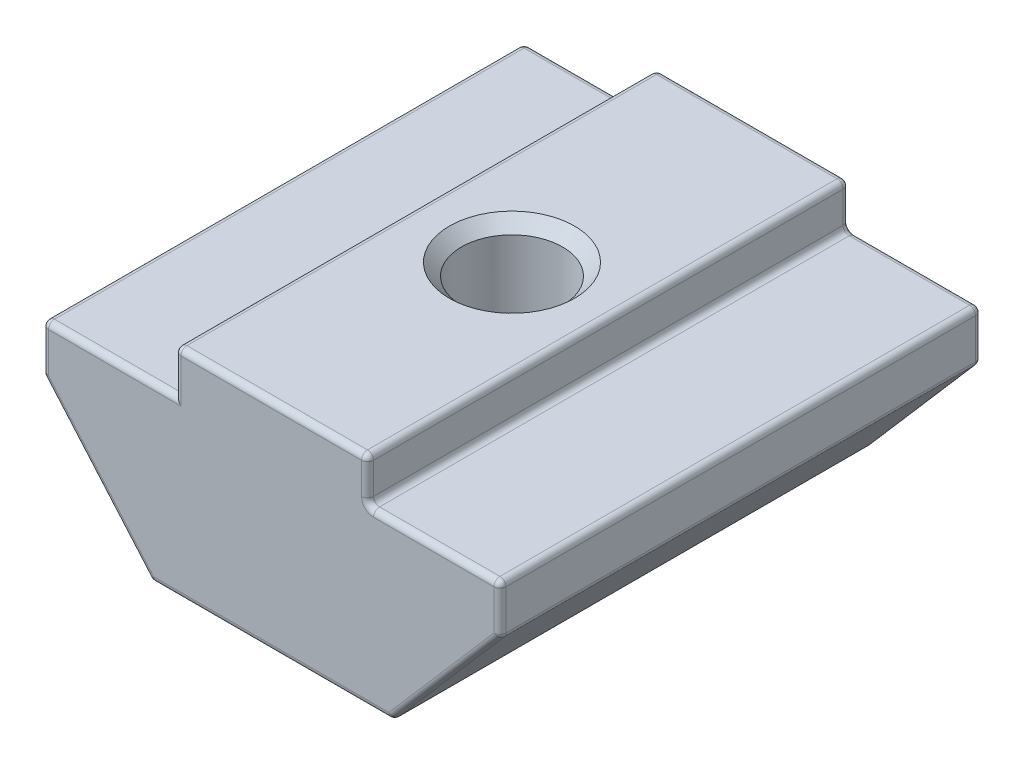
from build123d import *

# Parameters (mm, degrees)
BOSS_EXTRUDE1_DEPTH   = 20
M5X0_8_TAPPED_HOLE1_D = 4.2
CHAMFER1_SIZE         = 0.5
FILLET1_R             = 0.25


with BuildPart() as part:
    # Sketch1 → Boss-Extrude1 (new body)
    with BuildSketch(Plane.XY):
        Polygon((-4, 0), (4, 0), (4, -1.8), (9.5, -1.8), (9.5, -3.8), (5, -9), (-5, -9), (-9.5, -3.8), (-9.5, -1.8), (-4, -1.8), align=None)
    extrude(amount=BOSS_EXTRUDE1_DEPTH)

    # M5x0.8 Tapped Hole1 (through all)
    with Locations(Plane(origin=(0, 0, 0), x_dir=(1, 0, 0), z_dir=(0, 1, 0))):
        with Locations((0, -10)):
            Hole(M5X0_8_TAPPED_HOLE1_D / 2)

    # Chamfer1
    chamfer1_edges = [part.edges().sort_by_distance(p)[0] for p in [
        (2.1, 0, 10),
        (2.1, -9, 10),
    ]]
    chamfer(chamfer1_edges, length=CHAMFER1_SIZE)

    # Fillet1
    fillet1_edges = [part.edges().sort_by_distance(p)[0] for p in [
        (-4, -0.9, 20),
        (7.25, -6.4, 0),
        (0, -9, 0),
        (-7.25, -6.4, 0),
        (-9.5, -2.8, 0),
        (-6.75, -1.8, 0),
        (-4, -0.9, 0),
        (0, 0, 0),
        (4, -0.9, 0),
        (-6.75, -1.8, 20),
        (-9.5, -2.8, 20),
        (4, -1.8, 10),
        (9.5, -1.8, 10),
        (9.5, -3.8, 10),
        (5, -9, 10),
        (-5, -9, 10),
        (-9.5, -3.8, 10),
        (-9.5, -1.8, 10),
        (-4, 0, 10),
        (4, 0, 10),
        (-7.25, -6.4, 20),
        (0, -9, 20),
        (7.25, -6.4, 20),
        (9.5, -2.8, 20),
        (6.75, -1.8, 20),
        (4, -0.9, 20),
        (0, 0, 20),
        (6.75, -1.8, 0),
        (9.5, -2.8, 0),
    ]]
    fillet(fillet1_edges, radius=FILLET1_R)


solid = part.part
